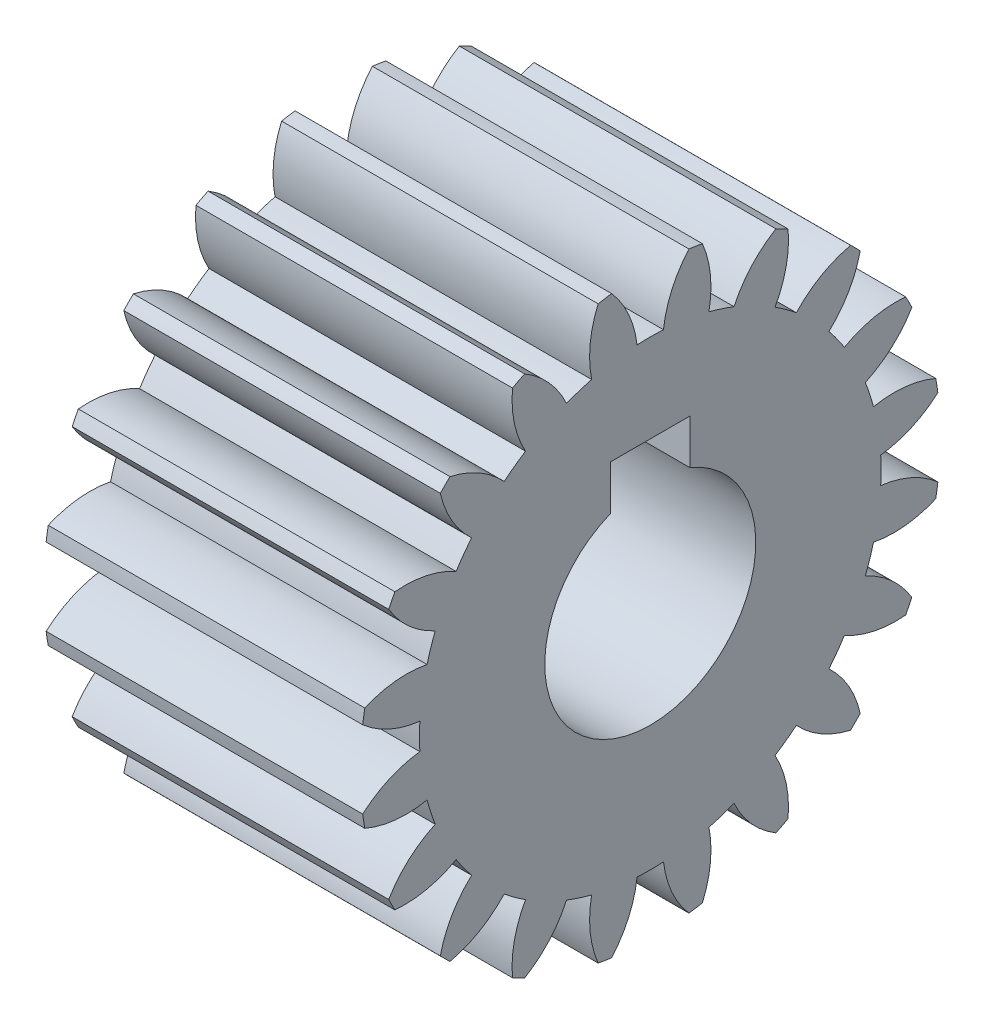
from build123d import *

# Parameters (mm, degrees)
BASPROSKE_W     = 12
BASPROSKE_H     = 11
TOOTHCUT_DEPTH  = 20.646882704
TEETHCUTS_COUNT = 20
TEETHCUTS_ANGLE = 342
BORSKE_R        = 4
BORE_DEPTH      = 50.0000508
KEYSKE_W        = 3
KEYSKE_H        = 5.4
KEYWAY_DEPTH    = 50.0000508


with BuildPart() as part:
    # BasProSke → Base-Revolve (revolve)
    with BuildSketch(Plane(origin=(0, 0, 0), x_dir=(1, 0, 0), z_dir=(0, 1, 0)), mode=Mode.PRIVATE) as base_revolve_sk:
        with Locations((6, 5.5)):
            Rectangle(BASPROSKE_W, BASPROSKE_H)
    revolve(base_revolve_sk.sketch.rotate(Axis((-10, 0, 0), (1, 0, 0)), 180), axis=Axis((-10, 0, 0), (1, 0, 0)))

    # TooCutSke → ToothCut (cut, through all)
    with BuildSketch(Plane(origin=(0, 0, 0), x_dir=(0, 0, -1), z_dir=(1, 0, 0))):
        with BuildLine():
            ThreePointArc((0.499924007, 8.734705318), (0, 8.749), (-0.499924007, 8.734705318))
            ThreePointArc((-0.499924007, 8.734705318), (-0.824302243, 9.905497836), (-1.485192705, 10.924909509))
            ThreePointArc((-1.485192705, 10.924909509), (0, 11.0254), (1.485192705, 10.924909509))
            ThreePointArc((1.485192705, 10.924909509), (0.824302243, 9.905497836), (0.499924007, 8.734705318))
        make_face()
    toothcut = extrude(amount=TOOTHCUT_DEPTH, mode=Mode.SUBTRACT)

    # TeethCuts: ToothCut ×20 about axis
    teethcuts_axis = Axis((-10, 0, 0), (1, 0, 0))
    for i in range(1, TEETHCUTS_COUNT):
        add(toothcut.rotate(teethcuts_axis, i * TEETHCUTS_ANGLE / (TEETHCUTS_COUNT - 1)), mode=Mode.SUBTRACT)

    # BorSke → Bore (cut, symmetric)
    with BuildSketch(Plane(origin=(0, 0, 0), x_dir=(0, 0, -1), z_dir=(1, 0, 0))):
        with Locations(Location((0, 0, 0), (0, 0, 180))):
            Circle(BORSKE_R)
    extrude(amount=BORE_DEPTH, both=True, mode=Mode.SUBTRACT)

    # KeySke → Keyway (cut, symmetric)
    with BuildSketch(Plane(origin=(0, 0, 0), x_dir=(0, 0, -1), z_dir=(1, 0, 0))):
        with Locations((0, 2.7)):
            Rectangle(KEYSKE_W, KEYSKE_H)
    extrude(amount=KEYWAY_DEPTH, both=True, mode=Mode.SUBTRACT)


solid = part.part
